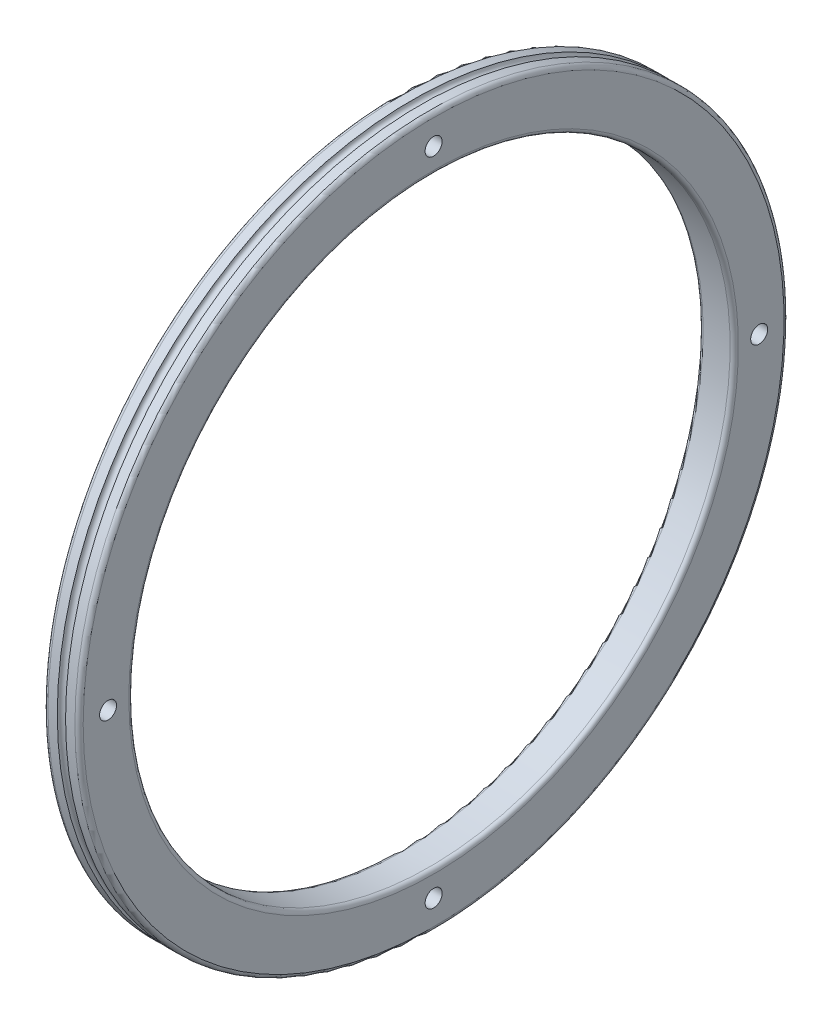
from build123d import *

# Parameters (mm, degrees)
FILLET1_R          = 1
CUT_EXTRUDE1_REACH = 123.214
SKETCH3_R          = 2.05


with BuildPart() as part:
    # Sketch1 → Revolve1 (revolve)
    with BuildSketch(Plane(origin=(0, 0, 0), x_dir=(1, 0, 0), z_dir=(0, 1, 0)), mode=Mode.PRIVATE) as revolve1_sk:
        with BuildLine():
            Line((-4.25, 85.5), (-0.998931619, 85.5))
            ThreePointArc((-0.998931619, 85.5), (0, 84.453787221), (0.998931619, 85.5))
            Line((0.998931619, 85.5), (4.25, 85.5))
            Line((4.25, 85.5), (4.25, 72.5))
            Line((4.25, 72.5), (-4.25, 72.5))
            Line((-4.25, 72.5), (-4.25, 85.5))
        make_face()
    revolve(revolve1_sk.sketch.rotate(Axis((-9.363221384, 0, 0), (1, 0, 0)), 180), axis=Axis((-9.363221384, 0, 0), (1, 0, 0)))

    # Fillet1
    fillet1_edges = [part.edges().sort_by_distance(p)[0] for p in [
        (-4.25, 0, -85.5),
        (4.25, 0, -85.5),
        (4.25, 0, -72.5),
        (-4.25, 0, -72.5),
    ]]
    fillet(fillet1_edges, radius=FILLET1_R)

    # Sketch3 → Cut-Extrude1 (cut, up to next)
    with BuildSketch(Plane(origin=(4.25, 0, 0), x_dir=(0, 0, -1), z_dir=(1, 0, 0)), mode=Mode.PRIVATE) as cut_extrude1_sk1:
        with Locations((-78.5, 0)):
            Circle(SKETCH3_R)
    cut_extrude1_tool1 = extrude(cut_extrude1_sk1.sketch, amount=-CUT_EXTRUDE1_REACH, mode=Mode.PRIVATE) & part.part
    # Sketch3 → Cut-Extrude1 (cut, up to next)
    with BuildSketch(Plane(origin=(4.25, 0, 0), x_dir=(0, 0, -1), z_dir=(1, 0, 0)), mode=Mode.PRIVATE) as cut_extrude1_sk2:
        with Locations((0, 78.5)):
            Circle(SKETCH3_R)
    cut_extrude1_tool2 = extrude(cut_extrude1_sk2.sketch, amount=-CUT_EXTRUDE1_REACH, mode=Mode.PRIVATE) & part.part
    # Sketch3 → Cut-Extrude1 (cut, up to next)
    with BuildSketch(Plane(origin=(4.25, 0, 0), x_dir=(0, 0, -1), z_dir=(1, 0, 0)), mode=Mode.PRIVATE) as cut_extrude1_sk3:
        with Locations((78.5, 0)):
            Circle(SKETCH3_R)
    cut_extrude1_tool3 = extrude(cut_extrude1_sk3.sketch, amount=-CUT_EXTRUDE1_REACH, mode=Mode.PRIVATE) & part.part
    # Sketch3 → Cut-Extrude1 (cut, up to next)
    with BuildSketch(Plane(origin=(4.25, 0, 0), x_dir=(0, 0, -1), z_dir=(1, 0, 0)), mode=Mode.PRIVATE) as cut_extrude1_sk4:
        with Locations((0, -78.5)):
            Circle(SKETCH3_R)
    cut_extrude1_tool4 = extrude(cut_extrude1_sk4.sketch, amount=-CUT_EXTRUDE1_REACH, mode=Mode.PRIVATE) & part.part
    add(cut_extrude1_tool1.solids().sort_by_distance((4.25, 0, 78.5))[0], mode=Mode.SUBTRACT)
    add(cut_extrude1_tool2.solids().sort_by_distance((4.25, 78.5, 0))[0], mode=Mode.SUBTRACT)
    add(cut_extrude1_tool3.solids().sort_by_distance((4.25, 0, -78.5))[0], mode=Mode.SUBTRACT)
    add(cut_extrude1_tool4.solids().sort_by_distance((4.25, -78.5, 0))[0], mode=Mode.SUBTRACT)


solid = part.part
